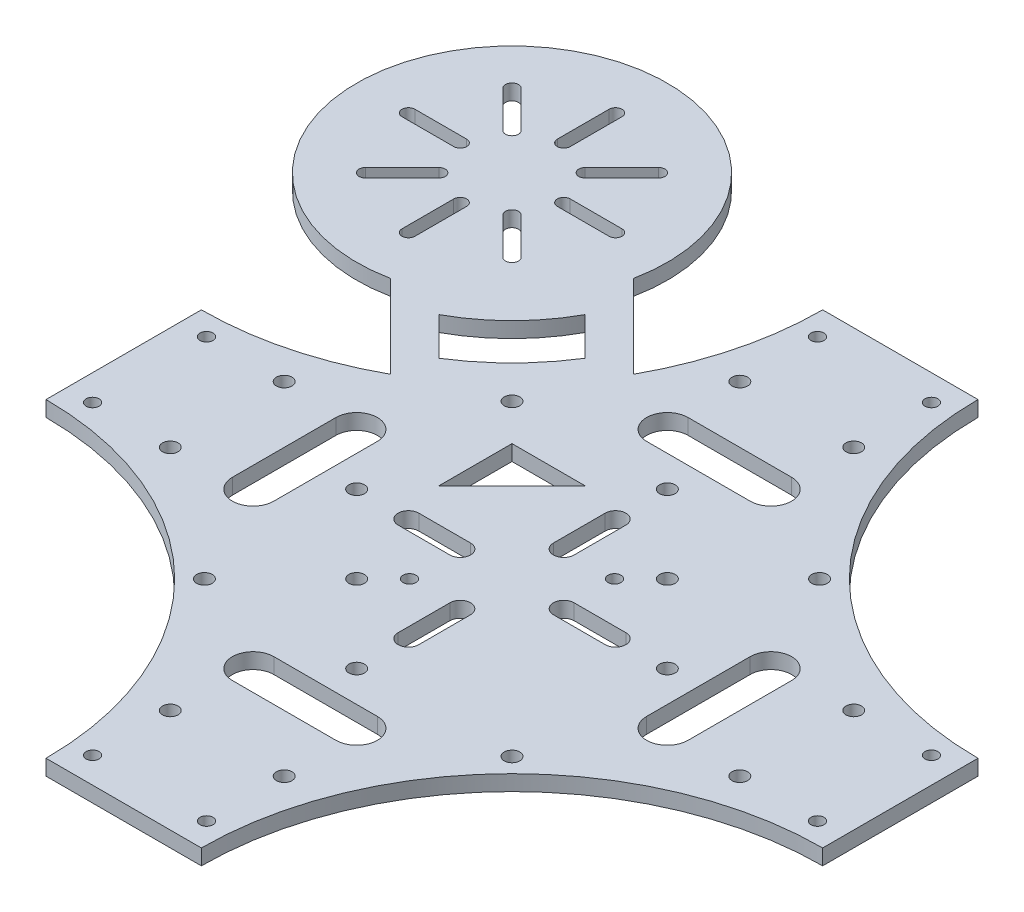
from build123d import *

# Parameters (mm, degrees)
SKETCH_1_R               = 1.25
EXTRUDE_1_DEPTH          = 3
SKETCH_2_R               = 1.5
CUT_EXTRUDE_1_DEPTH      = 3
CUT_EXTRUDE_2_DEPTH      = 3
CUT_EXTRUDE_3_DEPTH      = 3
CUT_EXTRUDE_4_DEPTH      = 10
SKETCH_6_R               = 1.5
CUT_EXTRUDE_5_DEPTH      = 10
SKETCH_7_R               = 1.5
CUT_EXTRUDE_8_DEPTH      = 10
SKETCH_8_R               = 1.5
CUT_EXTRUDE_9_DEPTH      = 10
SKETCH_9_R               = 15
CUT_EXTRUDE_10_DEPTH     = 10
SKETCH_11_R              = 1.5
EXTRUDE_3_DEPTH          = 3
CUT_EXTRUDE_12_DEPTH     = 3
EXTRUDE_4_DEPTH          = 3
SKETCH_15_R              = 15
EXTRUDE_5_DEPTH          = 3
CUT_EXTRUDE_13_DEPTH     = 3
EXTRUDE_START            = -3
EXTRUDE_7_DEPTH          = 3
CUT_EXTRUDE_14_DEPTH     = 3
CUT_EXTRUDE_15_DEPTH     = 3
PATTERN_CIRCULAR_1_COUNT = 8
SKETCH_22_R              = 1.25
CUT_EXTRUDE_17_DEPTH     = 3
SKETCH_23_R              = 1.5
CUT_EXTRUDE_18_DEPTH     = 10
SKETCH_24_R              = 1.5
CUT_EXTRUDE_19_DEPTH     = 10


with BuildPart() as part:
    # 草图1 → 凸台-拉伸1 (new body)
    # profile 1 of 4: a face of its own
    with BuildSketch(Plane(origin=(0, 0, 0), x_dir=(1, 0, 0), z_dir=(0, 1, 0))):
        with BuildLine():
            ThreePointArc((75, -15), (32.573593129, -32.573593129), (15, -75))
            Line((15, -75), (0, -75))
            Line((0, -75), (0, 0))
            Line((0, 0), (75, 0))
            Line((75, 0), (75, -15))
        make_face()
        with Locations(Location((11, -70, 0), (0, 0, 270))):
            Circle(SKETCH_1_R, mode=Mode.SUBTRACT)
        with Locations(Location((70, -11, 0), (0, 0, 270))):
            Circle(SKETCH_1_R, mode=Mode.SUBTRACT)
    # profile 2 of 4: a face of its own
    with BuildSketch(Plane(origin=(0, 0, 0), x_dir=(1, 0, 0), z_dir=(0, 1, 0))):
        with BuildLine():
            ThreePointArc((-15, -75), (-32.573593129, -32.573593129), (-75, -15))
            Line((-75, -15), (-75, 0))
            Line((-75, 0), (0, 0))
            Line((0, 0), (0, -75))
            Line((0, -75), (-15, -75))
        make_face()
        with Locations(Location((-70, -11, 0), (0, 0, 270))):
            Circle(SKETCH_1_R, mode=Mode.SUBTRACT)
        with Locations(Location((-11, -70, 0), (0, 0, 270))):
            Circle(SKETCH_1_R, mode=Mode.SUBTRACT)
    # profile 3 of 4: a face of its own
    with BuildSketch(Plane(origin=(0, 0, 0), x_dir=(1, 0, 0), z_dir=(0, 1, 0))):
        with BuildLine():
            ThreePointArc((-75, 15), (-32.573593129, 32.573593129), (-15, 75))
            Line((-15, 75), (0, 75))
            Line((0, 75), (0, 0))
            Line((0, 0), (-75, 0))
            Line((-75, 0), (-75, 15))
        make_face()
        with Locations(Location((-11, 70, 0), (0, 0, 270))):
            Circle(SKETCH_1_R, mode=Mode.SUBTRACT)
        with Locations(Location((-70, 11, 0), (0, 0, 270))):
            Circle(SKETCH_1_R, mode=Mode.SUBTRACT)
    # profile 4 of 4: a face of its own
    with BuildSketch(Plane(origin=(0, 0, 0), x_dir=(1, 0, 0), z_dir=(0, 1, 0))):
        with BuildLine():
            ThreePointArc((15, 75), (32.573593129, 32.573593129), (75, 15))
            Line((75, 15), (75, 0))
            Line((75, 0), (0, 0))
            Line((0, 0), (0, 75))
            Line((0, 75), (15, 75))
        make_face()
        with Locations(Location((70, 11, 0), (0, 0, 270))):
            Circle(SKETCH_1_R, mode=Mode.SUBTRACT)
        with Locations(Location((11, 70, 0), (0, 0, 270))):
            Circle(SKETCH_1_R, mode=Mode.SUBTRACT)
    extrude(amount=EXTRUDE_1_DEPTH)

    # 草图2 → 切除-拉伸1 (cut)
    with BuildSketch(Plane.XZ):
        with Locations(Location((0.353553391, -31.466251763, 0), (0, 0, 270))):
            Circle(SKETCH_2_R)
        with Locations(Location((31.466251763, -0.353553391, 0), (0, 0, 270))):
            Circle(SKETCH_2_R)
        with Locations(Location((-0.353553391, 31.466251763, 0), (0, 0, 90))):
            Circle(SKETCH_2_R)
        with Locations(Location((-31.466251763, 0.353553391, 0), (0, 0, 90))):
            Circle(SKETCH_2_R)
    extrude(amount=-CUT_EXTRUDE_1_DEPTH, mode=Mode.SUBTRACT)

    # 草图3 → 切除-拉伸2 (cut)
    with BuildSketch(Plane(origin=(0, 3, 0), x_dir=(1, 0, 0), z_dir=(0, 1, 0))):
        Polygon((-15.556349186, 15.556349186), (-12.02081528, 19.091883092), (-22.627416998, 22.627416998), align=None)
        Polygon((-19.091883092, 12.02081528), (-15.556349186, 15.556349186), (-22.627416998, 22.627416998), align=None)
    extrude(amount=-CUT_EXTRUDE_2_DEPTH, mode=Mode.SUBTRACT)

    # 草图4 → 切除-拉伸3 (cut)
    with BuildSketch(Plane(origin=(0, 3, 0), x_dir=(1, 0, 0), z_dir=(0, 1, 0))):
        with BuildLine():
            ThreePointArc((33.944668714, -19.80253309), (34.043922781, -8.582763971), (22.827665534, -8.285032838))
            Line((22.827665534, -8.285032838), (15.556349186, -15.556349186))
            Line((15.556349186, -15.556349186), (8.285032838, -22.827665534))
            ThreePointArc((8.285032838, -22.827665534), (8.582763971, -34.043922781), (19.80253309, -33.944668714))
            Line((19.80253309, -33.944668714), (33.944668714, -19.80253309))
        make_face()
    extrude(amount=-CUT_EXTRUDE_3_DEPTH, mode=Mode.SUBTRACT)

    # 草图5 → 切除-拉伸4 (cut)
    with BuildSketch(Plane(origin=(0, 3, 0), x_dir=(1, 0, 0), z_dir=(0, 1, 0))):
        Polygon((-22.627416998, 8.485281374), (-22.627416998, 22.627416998), (-19.091883092, 12.02081528), align=None)
        Polygon((-12.02081528, 19.091883092), (-22.627416998, 22.627416998), (-8.485281374, 22.627416998), align=None)
    extrude(amount=-CUT_EXTRUDE_4_DEPTH, mode=Mode.SUBTRACT)

    # 草图6 → 切除-拉伸5 (cut)
    with BuildSketch(Plane(origin=(0, 3, 0), x_dir=(1, 0, 0), z_dir=(0, 1, 0))):
        with Locations(Location((-35.355339059, -21.213203436, 0), (0, 0, 270))):
            Circle(SKETCH_6_R)
        with Locations(Location((-21.213203436, -35.355339059, 0), (0, 0, 270))):
            Circle(SKETCH_6_R)
        with Locations(Location((35.355339059, 21.213203436, 0), (0, 0, 270))):
            Circle(SKETCH_6_R)
        with Locations(Location((21.213203436, 35.355339059, 0), (0, 0, 270))):
            Circle(SKETCH_6_R)
    extrude(amount=-CUT_EXTRUDE_5_DEPTH, mode=Mode.SUBTRACT)

    # 草图7 → 切除-拉伸8 (cut)
    with BuildSketch(Plane(origin=(0, 3, 0), x_dir=(1, 0, 0), z_dir=(0, 1, 0))):
        with Locations(Location((-29.69848481, 29.69848481, 0), (0, 0, 270))):
            Circle(SKETCH_7_R)
        with Locations(Location((29.69848481, 29.69848481, 0), (0, 0, 270))):
            Circle(SKETCH_7_R)
        with Locations(Location((29.69848481, -29.69848481, 0), (0, 0, 270))):
            Circle(SKETCH_7_R)
        with Locations(Location((-29.69848481, -29.69848481, 0), (0, 0, 270))):
            Circle(SKETCH_7_R)
    extrude(amount=-CUT_EXTRUDE_8_DEPTH, mode=Mode.SUBTRACT)

    # 草图8 → 切除-拉伸9 (cut)
    with BuildSketch(Plane(origin=(0, 3, 0), x_dir=(1, 0, 0), z_dir=(0, 1, 0))):
        with Locations(Location((-11, 55, 0), (0, 0, 270))):
            Circle(SKETCH_8_R)
        with Locations(Location((11, 55, 0), (0, 0, 270))):
            Circle(SKETCH_8_R)
        with Locations(Location((55, 11, 0), (0, 0, 270))):
            Circle(SKETCH_8_R)
        with Locations(Location((55, -11, 0), (0, 0, 270))):
            Circle(SKETCH_8_R)
        with Locations(Location((11, -55, 0), (0, 0, 270))):
            Circle(SKETCH_8_R)
        with Locations(Location((-11, -55, 0), (0, 0, 270))):
            Circle(SKETCH_8_R)
        with Locations(Location((-55, -11, 0), (0, 0, 270))):
            Circle(SKETCH_8_R)
        with Locations(Location((-55, 11, 0), (0, 0, 270))):
            Circle(SKETCH_8_R)
    extrude(amount=-CUT_EXTRUDE_9_DEPTH, mode=Mode.SUBTRACT)

    # 草图9 → 切除-拉伸10 (cut)
    with BuildSketch(Plane(origin=(0, 3, 0), x_dir=(1, 0, 0), z_dir=(0, 1, 0))):
        with Locations(Location((0, 0, 0), (0, 0, 270))):
            Circle(SKETCH_9_R)
    extrude(amount=-CUT_EXTRUDE_10_DEPTH, mode=Mode.SUBTRACT)

    # 草图11 → 凸台-拉伸3 (add)
    with BuildSketch(Plane(origin=(0, 3, 0), x_dir=(1, 0, 0), z_dir=(0, 1, 0))):
        with Locations((-35.355339059, -21.213203436)):
            Circle(SKETCH_11_R)
        with Locations((35.355339059, 21.213203436)):
            Circle(SKETCH_11_R)
        with Locations((21.213203436, 35.355339059)):
            Circle(SKETCH_11_R)
        with Locations((0.353553391, 31.466251763)):
            Circle(SKETCH_11_R)
        with Locations((31.466251763, 0.353553391)):
            Circle(SKETCH_11_R)
        with Locations((-0.353553391, -31.466251763)):
            Circle(SKETCH_11_R)
        with Locations((-31.466251763, -0.353553391)):
            Circle(SKETCH_11_R)
        with Locations((-21.213203436, -35.355339059)):
            Circle(SKETCH_11_R)
    extrude(amount=-EXTRUDE_3_DEPTH)

    # 草图12 → 切除-拉伸12 (cut)
    with BuildSketch(Plane(origin=(0, 3, 0), x_dir=(1, 0, 0), z_dir=(0, 1, 0))):
        with BuildLine():
            Line((-44, -10), (-44, 10))
            ThreePointArc((-44, 10), (-40, 14), (-36, 10))
            Line((-36, 10), (-36, -10))
            ThreePointArc((-36, -10), (-40, -14), (-44, -10))
        make_face()
        with BuildLine():
            Line((-10, 44), (10, 44))
            ThreePointArc((10, 44), (14, 40), (10, 36))
            Line((10, 36), (-10, 36))
            ThreePointArc((-10, 36), (-14, 40), (-10, 44))
        make_face()
        with BuildLine():
            Line((44, 10), (44, -10))
            ThreePointArc((44, -10), (40, -14), (36, -10))
            Line((36, -10), (36, 10))
            ThreePointArc((36, 10), (40, 14), (44, 10))
        make_face()
        with BuildLine():
            Line((10, -44), (-10, -44))
            ThreePointArc((-10, -44), (-14, -40), (-10, -36))
            Line((-10, -36), (10, -36))
            ThreePointArc((10, -36), (14, -40), (10, -44))
        make_face()
    extrude(amount=-CUT_EXTRUDE_12_DEPTH, mode=Mode.SUBTRACT)

    # 草图14 → 凸台-拉伸4 (add)
    with BuildSketch(Plane(origin=(0, 3, 0), x_dir=(1, 0, 0), z_dir=(0, 1, 0))):
        with BuildLine():
            ThreePointArc((32.185650849, -7.152183109), (27.322232167, -6.195143755), (22.827665534, -8.285032838))
            Line((22.827665534, -8.285032838), (21.61516096, -18.569682002))
            ThreePointArc((21.61516096, -18.569682002), (27.487806659, -22.107425519), (33.944668714, -19.80253309))
            ThreePointArc((33.944668714, -19.80253309), (35.679936943, -17.205520658), (36.289282113, -14.142135624))
            ThreePointArc((36.289282113, -14.142135624), (35.187559777, -10.089382679), (32.185650849, -7.152183109))
        make_face()
        with BuildLine():
            Line((22.827665534, -8.285032838), (22.427168462, -8.685529911))
            ThreePointArc((22.427168462, -8.685529911), (20.306137435, -13.486712231), (21.61516096, -18.569682002))
            Line((21.61516096, -18.569682002), (22.827665534, -8.285032838))
        make_face()
        with BuildLine():
            Line((22.427168462, -8.685529911), (8.285032838, -22.827665534))
            ThreePointArc((8.285032838, -22.827665534), (8.582763971, -34.043922781), (19.80253309, -33.944668714))
            Line((19.80253309, -33.944668714), (21.61516096, -18.569682002))
            ThreePointArc((21.61516096, -18.569682002), (20.306137435, -13.486712231), (22.427168462, -8.685529911))
        make_face()
        with BuildLine():
            Line((21.61516096, -18.569682002), (19.80253309, -33.944668714))
            Line((19.80253309, -33.944668714), (33.944668714, -19.80253309))
            ThreePointArc((33.944668714, -19.80253309), (27.487806659, -22.107425519), (21.61516096, -18.569682002))
        make_face()
    extrude(amount=-EXTRUDE_4_DEPTH)

    # 草图15 → 凸台-拉伸5 (add)
    with BuildSketch(Plane(origin=(0, 3, 0), x_dir=(1, 0, 0), z_dir=(0, 1, 0))):
        Circle(SKETCH_15_R)
    extrude(amount=-EXTRUDE_5_DEPTH)

    # 草图17 → 切除-拉伸13 (cut)
    with BuildSketch(Plane(origin=(0, 3, 0), x_dir=(1, 0, 0), z_dir=(0, 1, 0))):
        with BuildLine():
            Line((-2, -20), (-2, -10))
            ThreePointArc((-2, -10), (0, -8), (2, -10))
            Line((2, -10), (2, -20))
            ThreePointArc((2, -20), (0, -22), (-2, -20))
        make_face()
        with BuildLine():
            Line((-20, 2), (-10, 2))
            ThreePointArc((-10, 2), (-8, 0), (-10, -2))
            Line((-10, -2), (-20, -2))
            ThreePointArc((-20, -2), (-22, 0), (-20, 2))
        make_face()
        with BuildLine():
            Line((2, 20), (2, 10))
            ThreePointArc((2, 10), (0, 8), (-2, 10))
            Line((-2, 10), (-2, 20))
            ThreePointArc((-2, 20), (0, 22), (2, 20))
        make_face()
        with BuildLine():
            Line((20, -2), (10, -2))
            ThreePointArc((10, -2), (8, 0), (10, 2))
            Line((10, 2), (20, 2))
            ThreePointArc((20, 2), (22, 0), (20, -2))
        make_face()
    extrude(amount=-CUT_EXTRUDE_13_DEPTH, mode=Mode.SUBTRACT)

    # 草图18 → 凸台-拉伸7 (add)
    with BuildSketch(Plane(origin=(0, 3, 0), x_dir=(1, 0, 0), z_dir=(0, 1, 0)).offset(EXTRUDE_START)):
        with BuildLine():
            Line((-61.977302058, 38.525223259), (-50.251262658, 50.251262658))
            Line((-50.251262658, 50.251262658), (-38.525223259, 61.977302058))
            ThreePointArc((-38.525223259, 61.977302058), (-38.078377186, 64.938218885), (-37.928932188, 67.928932188))
            ThreePointArc((-37.928932188, 67.928932188), (-91.15121571, 86.921708395), (-61.977302058, 38.525223259))
        make_face()
        with BuildLine():
            ThreePointArc((-61.977302058, 38.525223259), (-53.742560533, 41.49511182), (-46.715728753, 46.715728753))
            Line((-46.715728753, 46.715728753), (-50.251262658, 50.251262658))
            Line((-50.251262658, 50.251262658), (-61.977302058, 38.525223259))
        make_face()
        with BuildLine():
            Line((-50.251262658, 50.251262658), (-46.715728753, 46.715728753))
            ThreePointArc((-46.715728753, 46.715728753), (-41.49511182, 53.742560534), (-38.525223259, 61.977302058))
            Line((-38.525223259, 61.977302058), (-50.251262658, 50.251262658))
        make_face()
        with BuildLine():
            ThreePointArc((-45.952273324, 22.500194525), (-38.909748111, 27.067821679), (-32.573593129, 32.573593129))
            Line((-32.573593129, 32.573593129), (-46.715728753, 46.715728753))
            ThreePointArc((-46.715728753, 46.715728753), (-53.742560533, 41.49511182), (-61.977302058, 38.525223259))
            Line((-61.977302058, 38.525223259), (-45.952273324, 22.500194525))
        make_face()
        with BuildLine():
            Line((-46.715728753, 46.715728753), (-32.573593129, 32.573593129))
            ThreePointArc((-32.573593129, 32.573593129), (-27.067821679, 38.909748111), (-22.500194525, 45.952273324))
            Line((-22.500194525, 45.952273324), (-38.525223259, 61.977302058))
            ThreePointArc((-38.525223259, 61.977302058), (-41.49511182, 53.742560534), (-46.715728753, 46.715728753))
        make_face()
    extrude(amount=EXTRUDE_7_DEPTH)

    # 草图19 → 切除-拉伸14 (cut)
    with BuildSketch(Plane(origin=(0, 3, 0), x_dir=(1, 0, 0), z_dir=(0, 1, 0))):
        with BuildLine():
            ThreePointArc((-37.140781925, 51.282917549), (-39.866501787, 47.012431525), (-43.180194847, 43.180194847))
            Line((-43.180194847, 43.180194847), (-36.109127035, 36.109127035))
            ThreePointArc((-36.109127035, 36.109127035), (-32.750813989, 39.866501787), (-29.833680261, 43.975815885))
            Line((-29.833680261, 43.975815885), (-37.140781925, 51.282917549))
        make_face()
        with BuildLine():
            Line((-36.109127035, 36.109127035), (-43.180194847, 43.180194847))
            ThreePointArc((-43.180194847, 43.180194847), (-47.012431525, 39.866501787), (-51.282917549, 37.140781925))
            Line((-51.282917549, 37.140781925), (-43.975815885, 29.833680261))
            ThreePointArc((-43.975815885, 29.833680261), (-39.866501787, 32.750813989), (-36.109127035, 36.109127035))
        make_face()
    extrude(amount=-CUT_EXTRUDE_14_DEPTH, mode=Mode.SUBTRACT)

    # 草图21 → 切除-拉伸15 (cut)
    with BuildSketch(Plane(origin=(0, 3, 0), x_dir=(1, 0, 0), z_dir=(0, 1, 0))):
        with BuildLine():
            Line((-81.187184335, 82.954951288), (-74.116116524, 75.883883476))
            ThreePointArc((-74.116116524, 75.883883476), (-74.116116524, 74.116116524), (-75.883883476, 74.116116524))
            Line((-75.883883476, 74.116116524), (-82.954951288, 81.187184335))
            ThreePointArc((-82.954951288, 81.187184335), (-82.954951288, 82.954951288), (-81.187184335, 82.954951288))
        make_face()
        with BuildLine():
            Line((-59.9739809, 61.741747853), (-52.902913088, 54.670680041))
            ThreePointArc((-52.902913088, 54.670680041), (-52.902913088, 52.902913088), (-54.670680041, 52.902913088))
            Line((-54.670680041, 52.902913088), (-61.741747853, 59.9739809))
            ThreePointArc((-61.741747853, 59.9739809), (-61.741747853, 61.741747853), (-59.9739809, 61.741747853))
        make_face()
    cut_extrude_15 = extrude(amount=-CUT_EXTRUDE_15_DEPTH, mode=Mode.SUBTRACT)

    # 阵列(圆周)1: 切除-拉伸15 ×8 about axis
    pattern_circular_1_axis = Axis((-67.928932188, 0, -67.928932188), (0, 1, 0))
    for i in range(1, PATTERN_CIRCULAR_1_COUNT):
        add(cut_extrude_15.rotate(pattern_circular_1_axis, i * 360 / PATTERN_CIRCULAR_1_COUNT), mode=Mode.SUBTRACT)

    # 草图22 → 切除-拉伸17 (cut)
    with BuildSketch(Plane(origin=(0, 3, 0), x_dir=(1, 0, 0), z_dir=(0, 1, 0))):
        with Locations(Location((9.899494937, 9.899494937, 0), (0, 0, 270))):
            Circle(SKETCH_22_R)
        with Locations(Location((-9.899494937, -9.899494937, 0), (0, 0, 270))):
            Circle(SKETCH_22_R)
    extrude(amount=-CUT_EXTRUDE_17_DEPTH, mode=Mode.SUBTRACT)

    # 草图23 → 切除-拉伸18 (cut)
    with BuildSketch(Plane(origin=(0, 3, 0), x_dir=(1, 0, 0), z_dir=(0, 1, 0))):
        with Locations(Location((0, 30, 0), (0, 0, 270))):
            Circle(SKETCH_23_R)
        with Locations(Location((30, 0, 0), (0, 0, 270))):
            Circle(SKETCH_23_R)
        with Locations(Location((0, -30, 0), (0, 0, 270))):
            Circle(SKETCH_23_R)
        with Locations(Location((-30, 0, 0), (0, 0, 270))):
            Circle(SKETCH_23_R)
    extrude(amount=-CUT_EXTRUDE_18_DEPTH, mode=Mode.SUBTRACT)

    # 草图24 → 切除-拉伸19 (cut)
    with BuildSketch(Plane(origin=(0, 3, 0), x_dir=(1, 0, 0), z_dir=(0, 1, 0))):
        with Locations(Location((-15, -15, 0), (0, 0, 270))):
            Circle(SKETCH_24_R)
        with Locations(Location((15, 15, 0), (0, 0, 270))):
            Circle(SKETCH_24_R)
    extrude(amount=-CUT_EXTRUDE_19_DEPTH, mode=Mode.SUBTRACT)


solid = part.part
